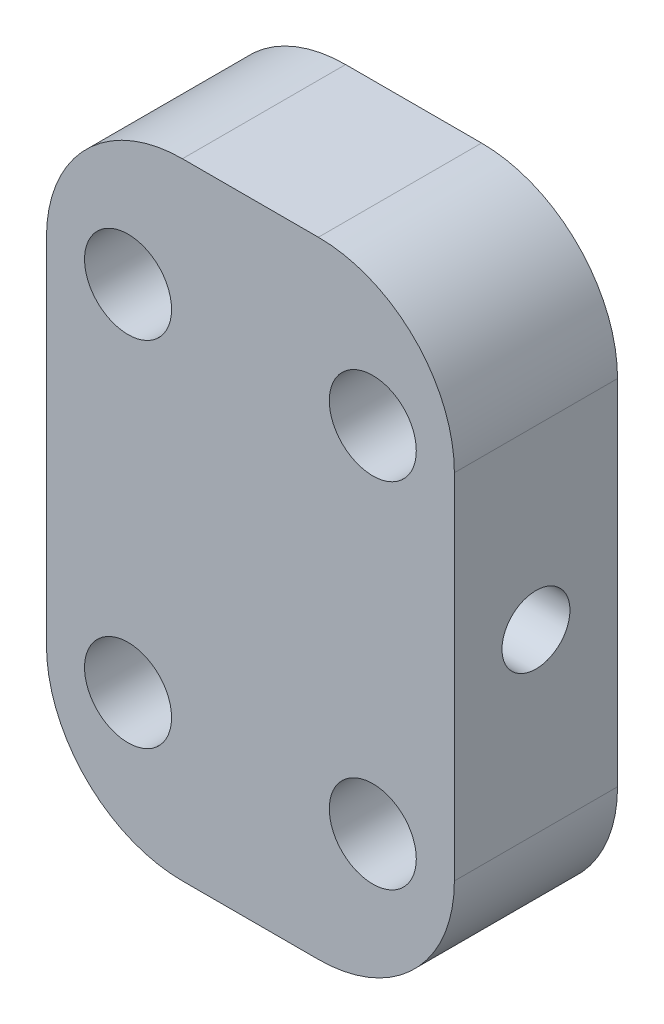
from build123d import *

# Parameters (mm, degrees)
SKETCH_1_W         = 15
SKETCH_1_H         = 23
EXTRUDE_1_DEPTH    = 3
FILLET_1_R         = 5
HOLE_WIZARD_M3_1_D = 3.2
M3X0_5_1_D         = 2.5


with BuildPart() as part:
    # ｽｹｯﾁ1 → ﾎﾞｽ - 押し出し1 (new, symmetric)
    with BuildSketch(Plane.XY):
        Rectangle(SKETCH_1_W, SKETCH_1_H)
    extrude(amount=EXTRUDE_1_DEPTH, both=True)

    # ﾌｨﾚｯﾄ1
    fillet_1_edges = [part.edges().sort_by_distance(p)[0] for p in [
        (7.5, -11.5, 0),
        (-7.5, -11.5, 0),
        (-7.5, 11.5, 0),
        (7.5, 11.5, 0),
    ]]
    fillet(fillet_1_edges, radius=FILLET_1_R)

    # M3 すきま穴1 (through all)
    with Locations(Plane(origin=(-4.5, 6.5, 3), x_dir=(1, 0, 0), z_dir=(0, 0, 1))):
        with Locations((0, 0), (9, 0), (9, -13), (0, -13)):
            Hole(HOLE_WIZARD_M3_1_D / 2)

    # M3x0.5 ねじ穴1 (through all)
    with Locations(Plane.YZ.offset(7.5)):
        with Locations((0, 0)):
            Hole(M3X0_5_1_D / 2)


solid = part.part
